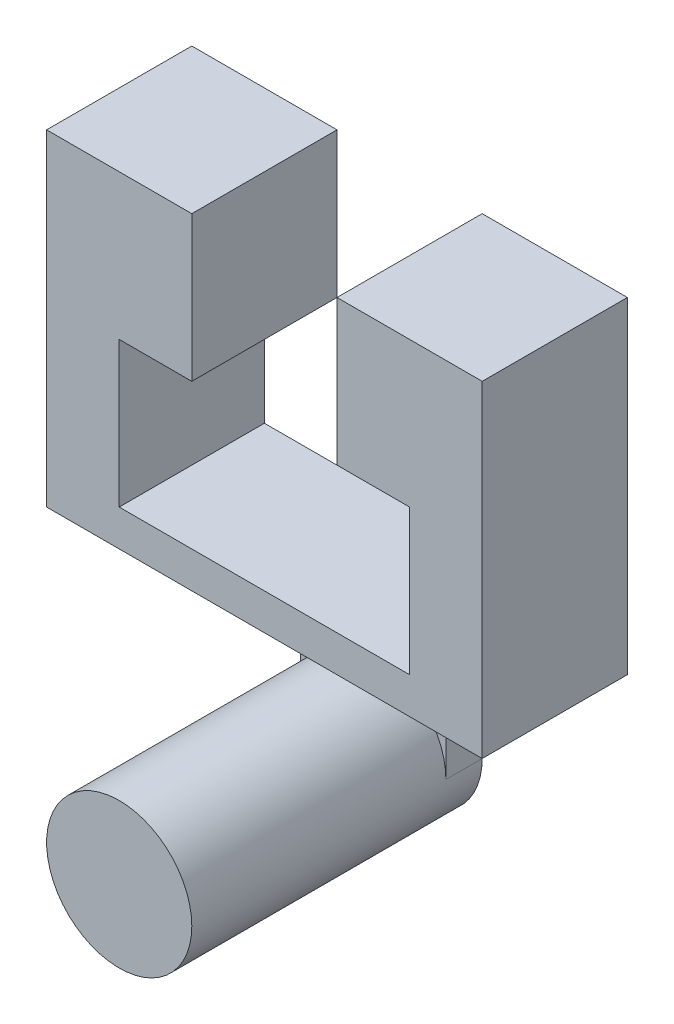
from build123d import *

# Parameters (mm, degrees)
BOSS_EXTRUDE1_DEPTH = 6.35
SKETCH2_R           = 12.7
BOSS_EXTRUDE2_DEPTH = 50.8
SKETCH3_W           = 76.2
SKETCH3_H           = 57.15
BOSS_EXTRUDE3_DEPTH = 25.4
CUT_EXTRUDE1_DEPTH  = 95.399536545


with BuildPart() as part:
    # Sketch1 → Boss-Extrude1 (new body)
    with BuildSketch(Plane.XY):
        with BuildLine():
            Line((-12.7, 0), (-12.7, 25.4))
            Line((-12.7, 25.4), (12.7, 25.4))
            Line((12.7, 25.4), (12.7, 0))
            ThreePointArc((12.7, 0), (0, 12.7), (-12.7, 0))
        make_face()
    extrude(amount=BOSS_EXTRUDE1_DEPTH)

    # Sketch2 → Boss-Extrude2 (add)
    with BuildSketch(Plane.XY):
        Circle(SKETCH2_R)
    extrude(amount=BOSS_EXTRUDE2_DEPTH)

    # Sketch3 → Boss-Extrude3 (add)
    with BuildSketch(Plane.XY):
        with Locations((0, 53.975)):
            Rectangle(SKETCH3_W, SKETCH3_H)
    extrude(amount=BOSS_EXTRUDE3_DEPTH)

    # Sketch4 → Cut-Extrude1 (cut, through all)
    with BuildSketch(Plane.XY.offset(25.4)):
        Polygon((12.7, 82.55), (12.7, 57.15), (25.4, 57.15), (25.4, 31.75), (-25.4, 31.75), (-25.4, 57.15), (-12.7, 57.15), (-12.7, 82.55), align=None)
    extrude(amount=-CUT_EXTRUDE1_DEPTH, mode=Mode.SUBTRACT)


solid = part.part
